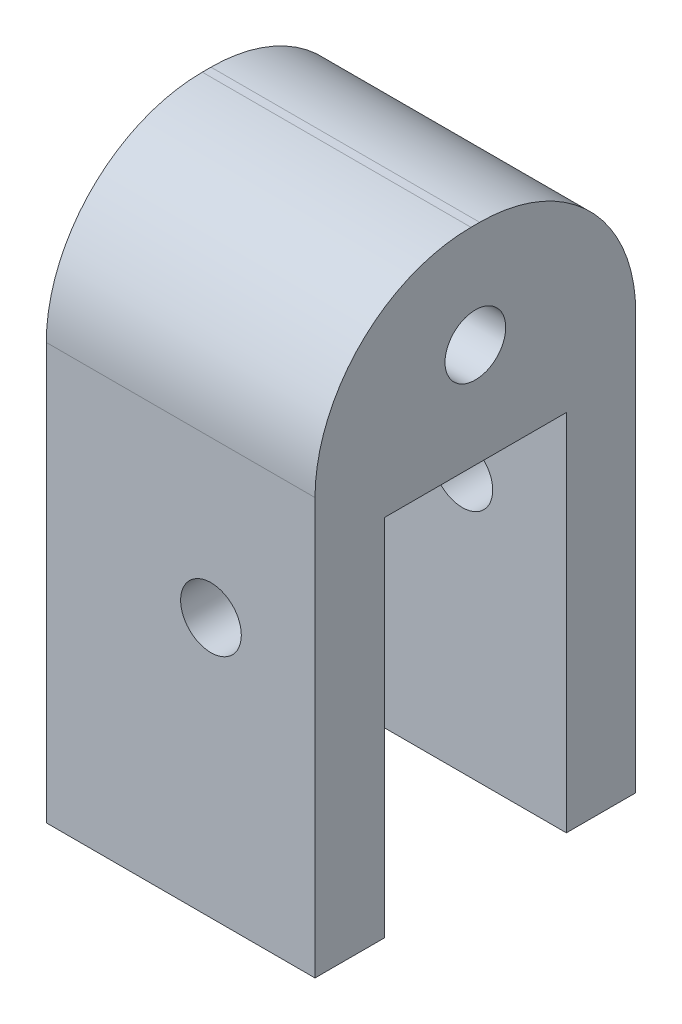
from build123d import *

# Parameters (mm, degrees)
EXTRUDE_1_DEPTH     = 21
SKETCH_2_W          = 15.5
SKETCH_2_H          = 12
EXTRUDE_2_DEPTH     = 18.5
SKETCH_4_R          = 1.75
CUT_EXTRUDE_2_DEPTH = 41.883982194
SKETCH_5_R          = 1.75
CUT_EXTRUDE_3_DEPTH = 41.883982194
SKETCH_6_R          = 1.75
CUT_EXTRUDE_4_DEPTH = 40.54111784
FILLET_1_R          = 9


with BuildPart() as part:
    # ｽｹｯﾁ1 → ﾎﾞｽ - 押し出し1 (new body)
    with BuildSketch(Plane(origin=(0, 0, 0), x_dir=(1, 0, 0), z_dir=(0, 1, 0))):
        Polygon((0, 18.5), (0, 0), (15.5, 0), (15.5, 4), (4, 4), (4, 14.5), (15.5, 14.5), (15.5, 18.5), align=None)
    extrude(amount=EXTRUDE_1_DEPTH)

    # ｽｹｯﾁ2 → ﾎﾞｽ - 押し出し2 (add)
    with BuildSketch(Plane.XY):
        with Locations((7.75, 27)):
            Rectangle(SKETCH_2_W, SKETCH_2_H)
    extrude(amount=-EXTRUDE_2_DEPTH)

    # ｽｹｯﾁ4 → ｶｯﾄ - 押し出し2 (cut, through all)
    with BuildSketch(Plane.XY):
        with Locations((9.5, 15)):
            Circle(SKETCH_4_R)
    extrude(amount=-CUT_EXTRUDE_2_DEPTH, mode=Mode.SUBTRACT)

    # ｽｹｯﾁ5 → ｶｯﾄ - 押し出し3 (cut, through all)
    with BuildSketch(Plane.ZY):
        with Locations((-9.25, 27)):
            Circle(SKETCH_5_R)
    extrude(amount=-CUT_EXTRUDE_3_DEPTH, mode=Mode.SUBTRACT)

    # ｽｹｯﾁ6 → ｶｯﾄ - 押し出し4 (cut, through all)
    with BuildSketch(Plane(origin=(4, 0, 0), x_dir=(0, 0, -1), z_dir=(1, 0, 0))):
        with Locations((9.25, 5)):
            Circle(SKETCH_6_R)
    extrude(amount=-CUT_EXTRUDE_4_DEPTH, mode=Mode.SUBTRACT)

    # ﾌｨﾚｯﾄ1
    fillet_1_edges = [part.edges().sort_by_distance(p)[0] for p in [
        (7.75, 33, -18.5),
        (7.75, 33, 0),
    ]]
    fillet(fillet_1_edges, radius=FILLET_1_R)


solid = part.part
